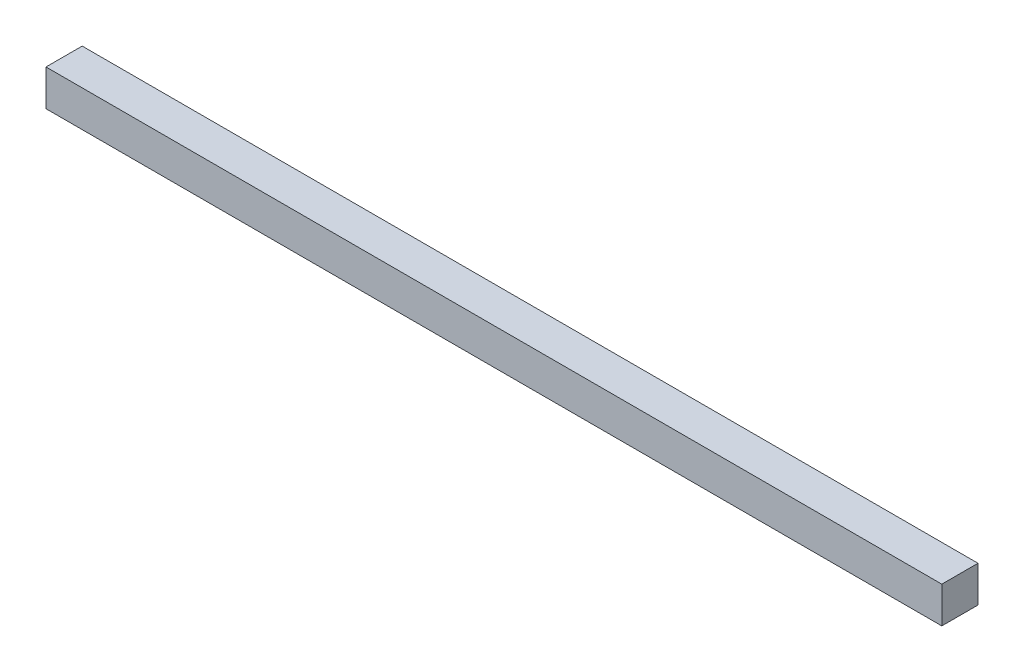
from build123d import *

# Parameters (mm, degrees)
EXTRUDE_1_DEPTH      = 10
EXTRUDE_1_DEPTH_BACK = 10
SKETCH_1_W           = 495
SKETCH_1_H           = 20


with BuildPart() as part:
    # 草图1 → 凸台-拉伸1 (new, two sides: drawn at the far end of the back side and taken through both)
    with BuildSketch(Plane.XY.offset(-EXTRUDE_1_DEPTH_BACK)):
        with Locations((173.033559273, 23.350001062)):
            Rectangle(SKETCH_1_W, SKETCH_1_H)
    extrude(amount=EXTRUDE_1_DEPTH + EXTRUDE_1_DEPTH_BACK)


solid = part.part
